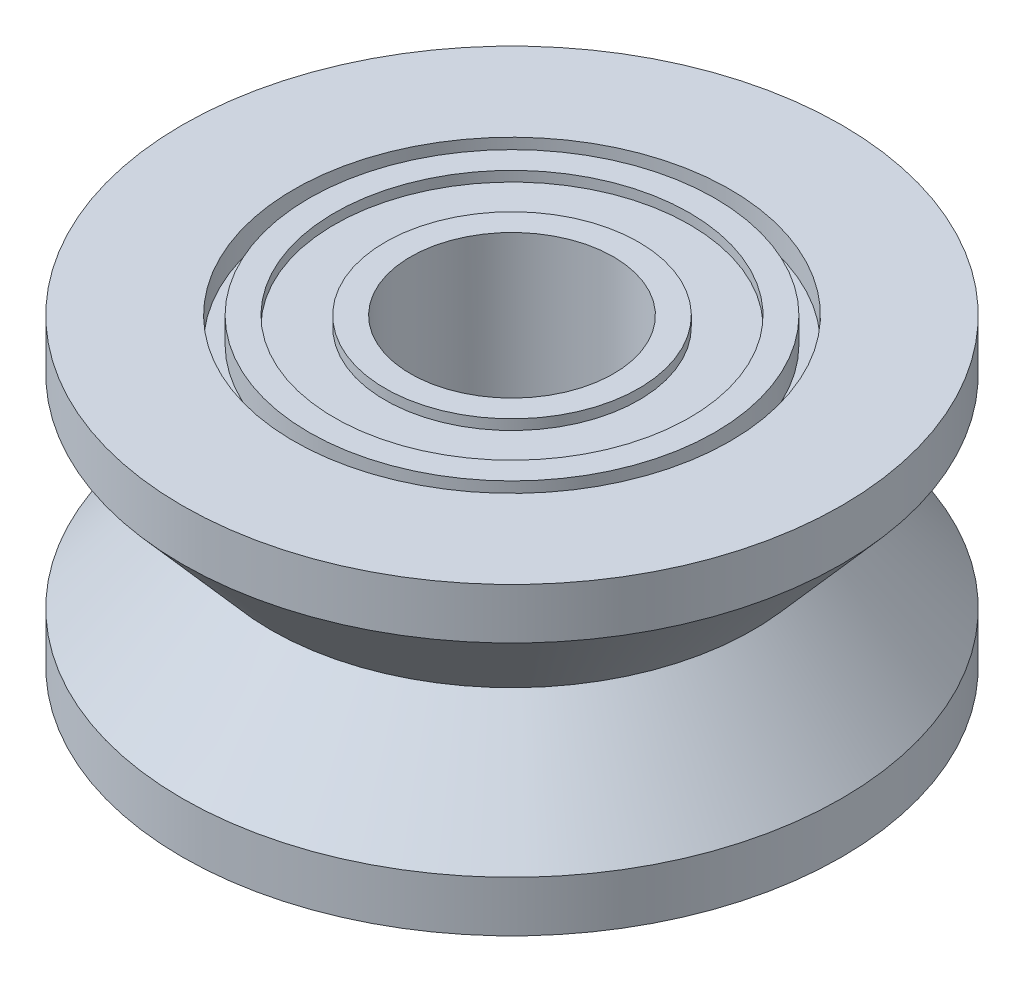
from build123d import *

# Parameters (mm, degrees)
SKETCH2_R               = 4.3
SKETCH2_R_2             = 4
CUT_EXTRUDE_THIN1_DEPTH = 0.5
SKETCH3_R               = 3.5
SKETCH3_R_2             = 2.5
CUT_EXTRUDE1_DEPTH      = 0.2
SKETCH4_R               = 4
CUT_EXTRUDE2_DEPTH      = 0.1


with BuildPart() as part:
    # Sketch1 → Revolve1 (revolve)
    with BuildSketch(Plane.XY, mode=Mode.PRIVATE) as revolve1_sk:
        Polygon((-6.5, 3), (-6.5, 2), (-4.75, 0), (-6.5, -2), (-6.5, -3), (-2, -3), (-2, 3), align=None)
    revolve(revolve1_sk.sketch.rotate(Axis((0, 0, 0), (0, 1, 0)), 270), axis=Axis((0, 0, 0), (0, 1, 0)))

    # Sketch2 → Cut-Extrude-Thin1 (cut)
    with BuildSketch(Plane.XZ.offset(3)):
        Circle(SKETCH2_R)
        Circle(SKETCH2_R_2, mode=Mode.SUBTRACT)
    cut_extrude_thin1 = extrude(amount=-CUT_EXTRUDE_THIN1_DEPTH, mode=Mode.SUBTRACT)

    # Sketch3 → Cut-Extrude1 (cut)
    with BuildSketch(Plane.XZ.offset(3)):
        with Locations(Location((0, 0, 0), (0, 0, 270))):
            Circle(SKETCH3_R)
        with Locations(Location((0, 0, 0), (0, 0, 270))):
            Circle(SKETCH3_R_2, mode=Mode.SUBTRACT)
    cut_extrude1 = extrude(amount=-CUT_EXTRUDE1_DEPTH, mode=Mode.SUBTRACT)

    # Mirror1: Cut-Extrude-Thin1, Cut-Extrude1 across plane
    add(cut_extrude_thin1.mirror(Plane.ZX), mode=Mode.SUBTRACT)
    add(cut_extrude1.mirror(Plane.ZX), mode=Mode.SUBTRACT)

    # Sketch4 → Cut-Extrude2 (cut, symmetric)
    with BuildSketch(Plane(origin=(0, 0, 0), x_dir=(1, 0, 0), z_dir=(0, 1, 0))):
        with Locations(Location((0, 0, 0), (0, 0, 90))):
            Circle(SKETCH4_R)
    extrude(amount=CUT_EXTRUDE2_DEPTH, both=True, mode=Mode.SUBTRACT)


solid = part.part
